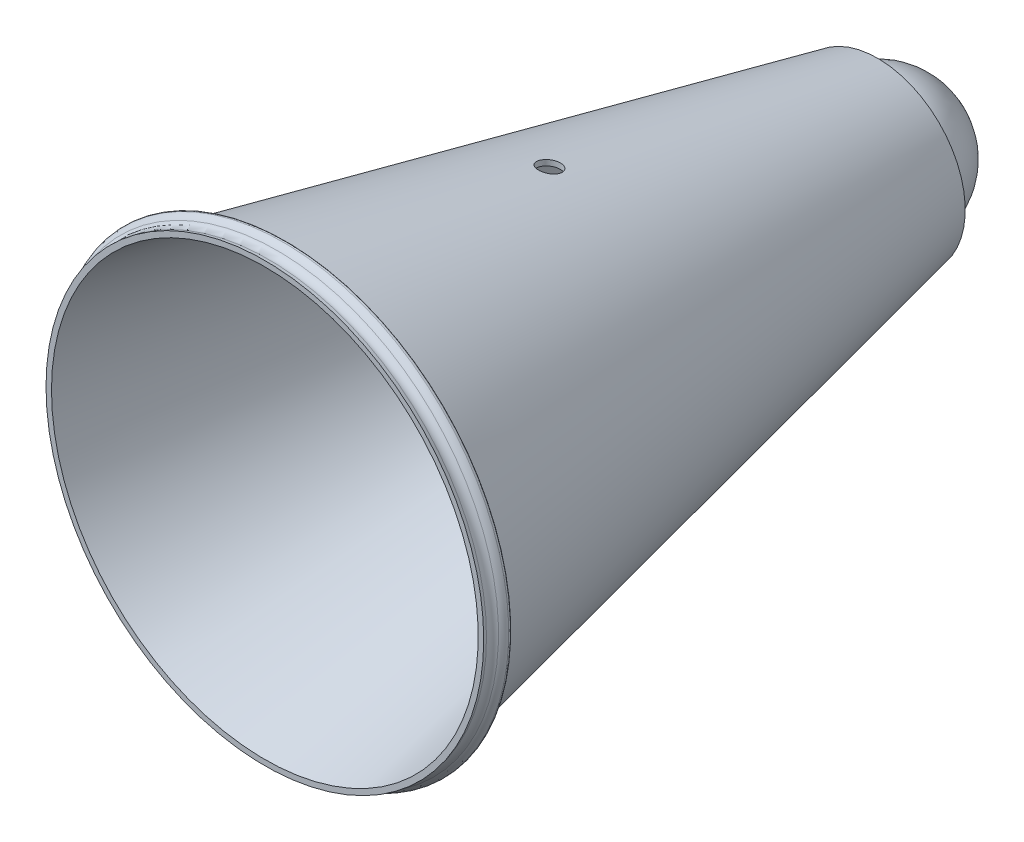
from build123d import *

# Parameters (mm, degrees)
CUT_EXTRUDE1_DEPTH      = 201.445503114
CUT_EXTRUDE1_DEPTH_BACK = 201.445503114
SKETCH2_R               = 3.175


with BuildPart() as part:
    # Sketch1 → Revolve1 (revolve)
    with BuildSketch(Plane(origin=(0, 0, 0), x_dir=(0, 0, -1), z_dir=(1, 0, 0)), mode=Mode.PRIVATE) as revolve1_sk:
        with BuildLine():
            Line((-170.558103969, 61.982800726), (0, 25.4))
            Line((0, 25.4), (0, 20.6375))
            ThreePointArc((0, 20.6375), (14.592916197, 14.592916197), (20.6375, 0))
            Line((20.6375, 0), (19.05, 0))
            ThreePointArc((19.05, 0), (13.470384182, 13.470384182), (0, 19.05))
            Line((0, 19.05), (-12.7, 19.05))
            Line((-12.7, 19.05), (-12.7, 26.500401371))
            Line((-12.7, 26.500401371), (-177.8, 61.9125))
            Line((-177.8, 61.9125), (-177.8, 63.5))
            Line((-177.8, 63.5), (-176.773784801, 63.279888347))
            ThreePointArc((-176.773784801, 63.279888347), (-175.364378816, 63.379506676), (-174.226260414, 64.21678533))
            ThreePointArc((-174.226260414, 64.21678533), (-173.438552848, 64.958591119), (-172.456828691, 65.413538059))
            ThreePointArc((-172.456828691, 65.413538059), (-171.763807138, 65.28185552), (-171.45, 64.650076885))
            Line((-171.45, 64.650076885), (-171.45, 63.086283803))
            ThreePointArc((-171.45, 63.086283803), (-171.199147092, 62.376855612), (-170.558103969, 61.982800726))
        make_face()
    revolve(revolve1_sk.sketch.rotate(Axis((0, 0, 0), (0, 0, 1)), 90), axis=Axis((0, 0, 0), (0, 0, 1)))

    # Sketch2 → Cut-Extrude1 (cut, two sides: drawn at the far end of the back side and taken through both)
    with BuildSketch(Plane(origin=(0, 0, 0), x_dir=(1, 0, 0), z_dir=(0, 1, 0)).offset(-CUT_EXTRUDE1_DEPTH_BACK)):
        with Locations(Location((0, -95.25, 0), (0, 0, 124.156091497))):
            Circle(SKETCH2_R)
    extrude(amount=CUT_EXTRUDE1_DEPTH + CUT_EXTRUDE1_DEPTH_BACK, mode=Mode.SUBTRACT)


solid = part.part
